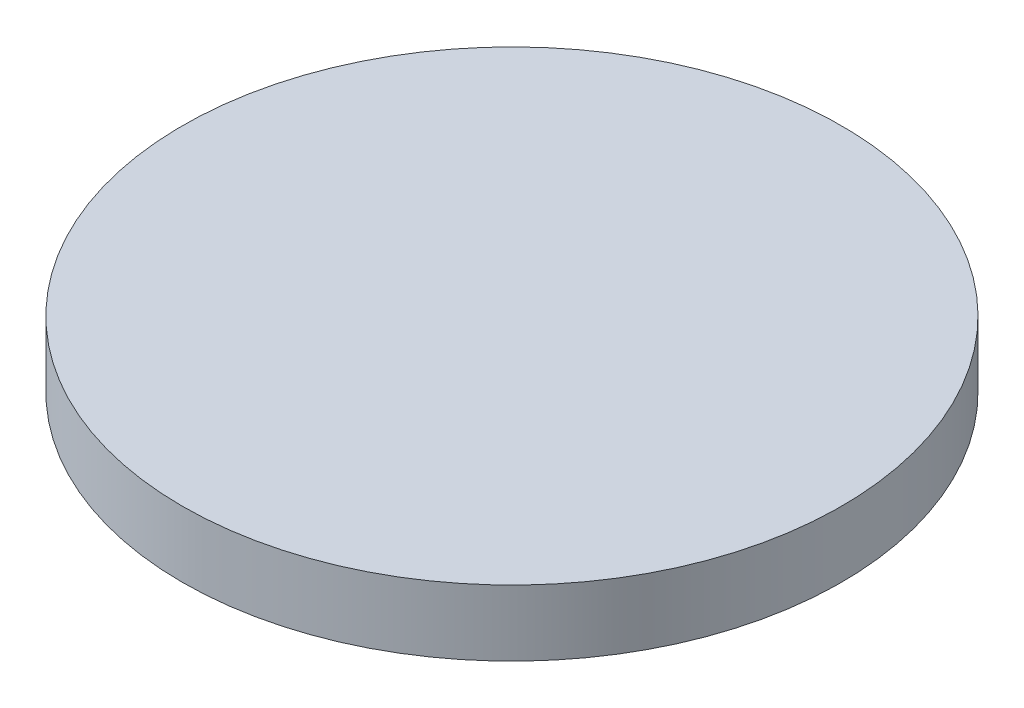
from build123d import *

# Parameters (mm, degrees)
SKETCH1_R           = 10
BOSS_EXTRUDE1_DEPTH = 2
SKETCH2_R           = 4.9
BOSS_EXTRUDE2_DEPTH = 2.9


with BuildPart() as part:
    # Sketch1 → Boss-Extrude1 (new body)
    with BuildSketch(Plane(origin=(0, 0, 0), x_dir=(1, 0, 0), z_dir=(0, 1, 0))):
        with Locations(Location((0, 0, 0), (0, 0, 270))):
            Circle(SKETCH1_R)
    extrude(amount=BOSS_EXTRUDE1_DEPTH)

    # Sketch2 → Boss-Extrude2 (add)
    with BuildSketch(Plane.XZ):
        with Locations(Location((0, 0, 0), (0, 0, 90))):
            Circle(SKETCH2_R)
    extrude(amount=BOSS_EXTRUDE2_DEPTH)


solid = part.part
